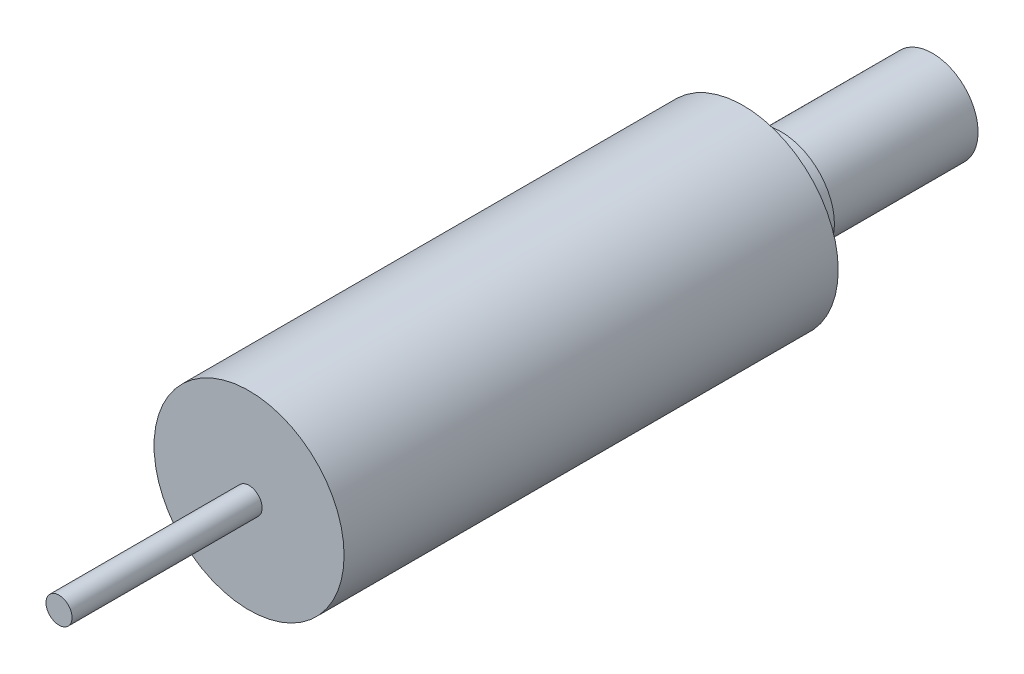
from build123d import *

# Parameters (mm, degrees)
SKETCH1_R                  = 6
BEARING_JOURNAL_12MM_DEPTH = 19.9
SKETCH2_R                  = 7
BOSS_EXTRUDE2_DEPTH        = 5
SKETCH3_R                  = 12.5
BODY_M25_DEPTH             = 65
SKETCH4_R                  = 1.714870996
CABLE_DEPTH                = 25
SKETCH5_R                  = 3
CUT_EXTRUDE_M6_DEPTH       = 10


with BuildPart() as part:
    # Sketch1 → Bearing Journal-12mm (new body)
    with BuildSketch(Plane.XY):
        with Locations(Location((0, 0, 0), (0, 0, 180))):
            Circle(SKETCH1_R)
    extrude(amount=BEARING_JOURNAL_12MM_DEPTH)

    # Sketch2 → Boss-Extrude2 (add)
    with BuildSketch(Plane.XY.offset(19.9)):
        Circle(SKETCH2_R)
    extrude(amount=BOSS_EXTRUDE2_DEPTH)

    # Sketch3 → Body-M25 (add)
    with BuildSketch(Plane.XY.offset(24.9)):
        Circle(SKETCH3_R)
    extrude(amount=BODY_M25_DEPTH)

    # Sketch4 → Cable (add)
    with BuildSketch(Plane.XY.offset(89.9)):
        Circle(SKETCH4_R)
    extrude(amount=CABLE_DEPTH)

    # Sketch5 → Cut-Extrude M6 (cut)
    with BuildSketch(Plane(origin=(0, 0, 0), x_dir=(-1, 0, 0), z_dir=(0, 0, -1))):
        Circle(SKETCH5_R)
    extrude(amount=-CUT_EXTRUDE_M6_DEPTH, mode=Mode.SUBTRACT)


solid = part.part
